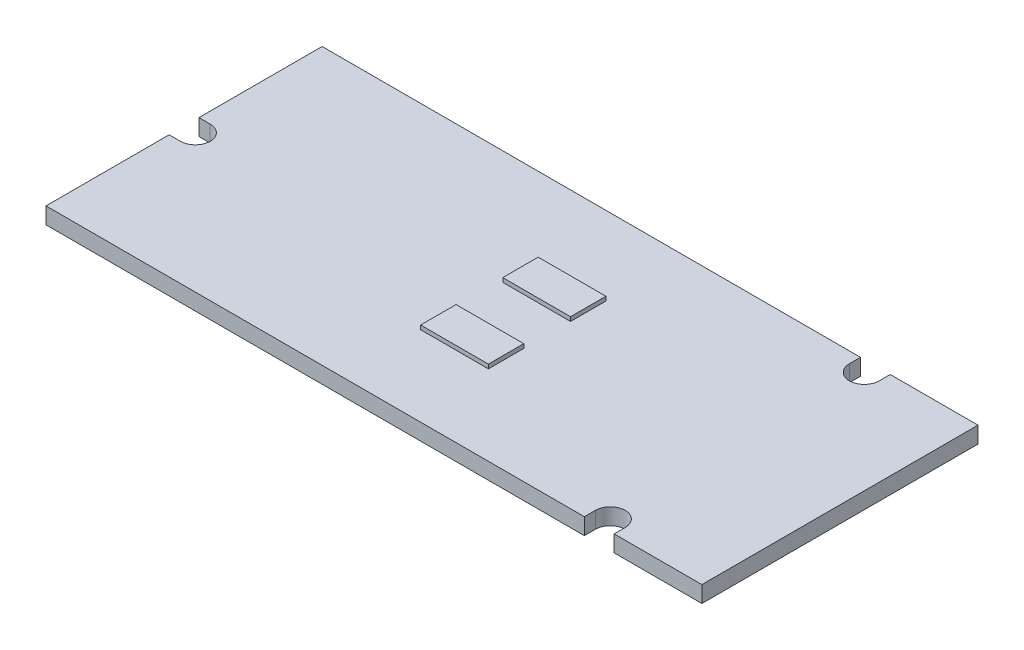
from build123d import *

# Parameters (mm, degrees)
BOSS_EXTRUDE1_DEPTH = 1.6
SKETCH2_W           = 6.6
SKETCH2_H           = 3.45
BOSS_EXTRUDE2_DEPTH = 0.4


with BuildPart() as part:
    # Sketch1 → Boss-Extrude1 (new body)
    with BuildSketch(Plane(origin=(0, 0, 0), x_dir=(1, 0, 0), z_dir=(0, 1, 0))):
        with BuildLine():
            Line((31.95, -13.45), (23.4, -13.45))
            Line((23.4, -13.45), (23.4, -12.375))
            ThreePointArc((23.4, -12.375), (21.95, -10.925), (20.5, -12.375))
            Line((20.5, -12.375), (20.5, -13.45))
            Line((20.5, -13.45), (-31.95, -13.45))
            Line((-31.95, -13.45), (-31.95, -1.45))
            Line((-31.95, -1.45), (-30.85, -1.45))
            ThreePointArc((-30.85, -1.45), (-29.4, 0), (-30.85, 1.45))
            Line((-30.85, 1.45), (-31.95, 1.45))
            Line((-31.95, 1.45), (-31.95, 13.45))
            Line((-31.95, 13.45), (20.5, 13.45))
            Line((20.5, 13.45), (20.5, 12.375))
            ThreePointArc((20.5, 12.375), (21.95, 10.925), (23.4, 12.375))
            Line((23.4, 12.375), (23.4, 13.45))
            Line((23.4, 13.45), (31.95, 13.45))
            Line((31.95, 13.45), (31.95, -13.45))
        make_face()
    extrude(amount=BOSS_EXTRUDE1_DEPTH)

    # Sketch2 → Boss-Extrude2 (add)
    with BuildSketch(Plane(origin=(0, 1.6, 0), x_dir=(1, 0, 0), z_dir=(0, 1, 0))):
        with Locations((0.05, 4.075)):
            Rectangle(SKETCH2_W, SKETCH2_H)
        with Locations((0.05, -3.925)):
            Rectangle(SKETCH2_W, SKETCH2_H)
    extrude(amount=BOSS_EXTRUDE2_DEPTH)


solid = part.part
